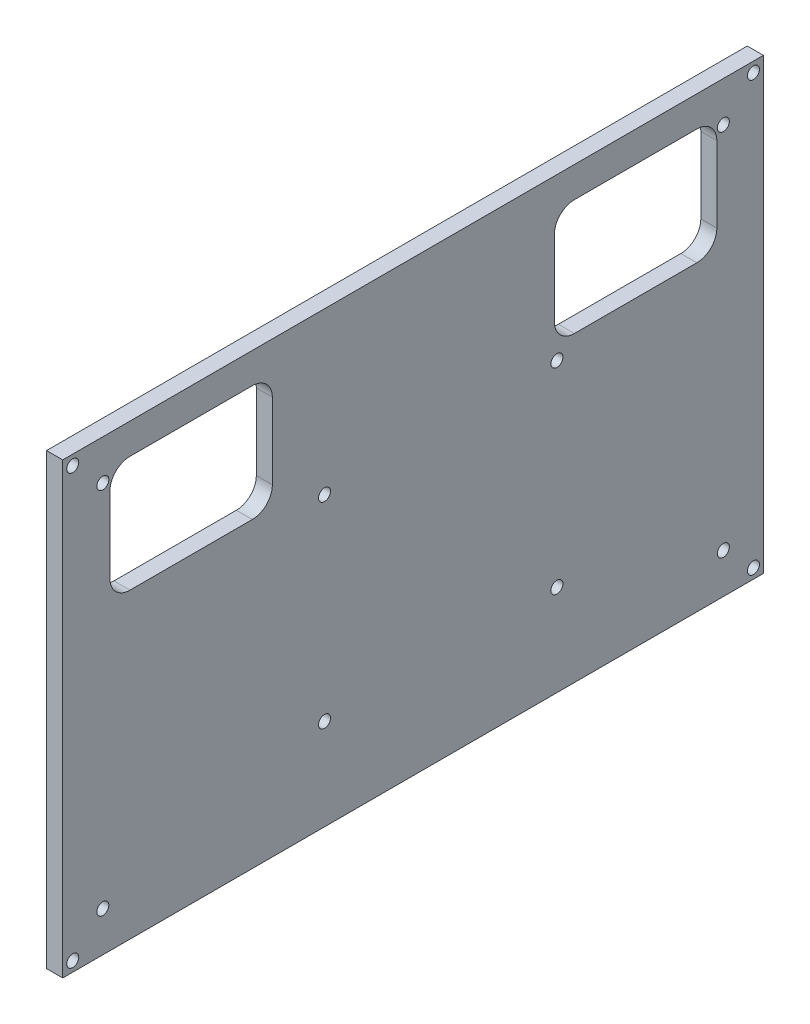
from build123d import *

# Parameters (mm, degrees)
CROQUIS1_W              = 164.9
CROQUIS1_H              = 102
SALIENTE_EXTRUIR2_DEPTH = 14.27
CROQUIS2_W              = 174.9
CROQUIS2_H              = 112
CROQUIS2_W_2            = 166.9
CROQUIS2_H_2            = 104
SALIENTE_EXTRUIR3_DEPTH = 14.27
CROQUIS3_W              = 174.9
CROQUIS3_H              = 112
CROQUIS3_W_2            = 160.9
CROQUIS3_H_2            = 98.374406292
SALIENTE_EXTRUIR5_DEPTH = 1
CROQUIS4_W              = 164.9
CROQUIS4_H              = 102
CORTAR_EXTRUIR2_DEPTH   = 14.27
CROQUIS6_W              = 174.9
CROQUIS6_H              = 112
CROQUIS6_R              = 1.5
SALIENTE_EXTRUIR6_DEPTH = 15
CROQUIS8_W              = 160.9
CROQUIS8_H              = 98.374406292
CORTAR_EXTRUIR3_DEPTH   = 9
CROQUIS9_W              = 166.9
CROQUIS9_H              = 104
CORTAR_EXTRUIR5_DEPTH   = 11
CROQUIS15_W             = 6.3
CROQUIS15_H             = 15
CROQUIS15_W_2           = 3.5
CROQUIS15_H_2           = 7
CORTAR_EXTRUIR6_DEPTH   = 7
CORTAR_EXTRUIR7_DEPTH   = 7
CROQUIS17_R             = 4
CORTAR_EXTRUIR8_DEPTH   = 7
CROQUIS18_W             = 4
CROQUIS18_H             = 16
CORTAR_EXTRUIR9_DEPTH   = 7
CROQUIS21_R             = 1.5
CORTAR_EXTRUIR12_DEPTH  = 25.4
CROQUIS22_W             = 26.235894962
CROQUIS22_H             = 112
CORTAR_EXTRUIR14_DEPTH  = 200.4


with BuildPart() as part:
    # Croquis1 → Saliente-Extruir2 (new body)
    with BuildSketch(Plane(origin=(0, 0, 0), x_dir=(0, 0, -1), z_dir=(1, 0, 0))):
        Rectangle(CROQUIS1_W, CROQUIS1_H)
    extrude(amount=SALIENTE_EXTRUIR2_DEPTH)

    # Croquis4 → Cortar-Extruir2 (cut)
    with BuildSketch(Plane(origin=(14.27, 0, 0), x_dir=(0, 0, -1), z_dir=(1, 0, 0))):
        Rectangle(CROQUIS4_W, CROQUIS4_H)
    extrude(amount=-CORTAR_EXTRUIR2_DEPTH, mode=Mode.SUBTRACT)


with BuildPart() as body_2:
    # Croquis2 → Saliente-Extruir3 (new body)
    with BuildSketch(Plane(origin=(0, 0, 0), x_dir=(0, 0, -1), z_dir=(1, 0, 0))):
        Rectangle(CROQUIS2_W, CROQUIS2_H)
        Rectangle(CROQUIS2_W_2, CROQUIS2_H_2, mode=Mode.SUBTRACT)
    extrude(amount=SALIENTE_EXTRUIR3_DEPTH)

    # Croquis3 → Saliente-Extruir5 (add)
    with BuildSketch(Plane.ZY):
        Rectangle(CROQUIS3_W, CROQUIS3_H)
        with Locations((0, -0.062203146)):
            Rectangle(CROQUIS3_W_2, CROQUIS3_H_2, mode=Mode.SUBTRACT)
    extrude(amount=SALIENTE_EXTRUIR5_DEPTH)

    # Croquis6 → Saliente-Extruir6 (add)
    with BuildSketch(Plane(origin=(14.27, 0, 0), x_dir=(0, 0, -1), z_dir=(1, 0, 0))):
        Rectangle(CROQUIS6_W, CROQUIS6_H)
        with Locations((-77.445, 46)):
            Circle(CROQUIS6_R, mode=Mode.SUBTRACT)
        with Locations((-77.445, -46)):
            Circle(CROQUIS6_R, mode=Mode.SUBTRACT)
        with Locations((-22.1, 15.81)):
            Circle(CROQUIS6_R, mode=Mode.SUBTRACT)
        with Locations((35.9, 15.81)):
            Circle(CROQUIS6_R, mode=Mode.SUBTRACT)
        with Locations((-22.1, -33.19)):
            Circle(CROQUIS6_R, mode=Mode.SUBTRACT)
        with Locations((35.9, -33.19)):
            Circle(CROQUIS6_R, mode=Mode.SUBTRACT)
        with Locations((77.445, 46)):
            Circle(CROQUIS6_R, mode=Mode.SUBTRACT)
        with Locations((77.445, -46)):
            Circle(CROQUIS6_R, mode=Mode.SUBTRACT)
    extrude(amount=SALIENTE_EXTRUIR6_DEPTH)

    # Croquis8 → Cortar-Extruir3 (cut)
    with BuildSketch(Plane.ZY.offset(-14.27)):
        with Locations((0, -0.062203146)):
            Rectangle(CROQUIS8_W, CROQUIS8_H)
    extrude(amount=-CORTAR_EXTRUIR3_DEPTH, mode=Mode.SUBTRACT)

    # Croquis9 → Cortar-Extruir5 (cut)
    with BuildSketch(Plane.ZY.offset(-14.27)):
        Rectangle(CROQUIS9_W, CROQUIS9_H)
    extrude(amount=-CORTAR_EXTRUIR5_DEPTH, mode=Mode.SUBTRACT)

    # Croquis15 → Cortar-Extruir6 (cut)
    with BuildSketch(Plane.XY.offset(87.45)):
        with Locations((18.42, 9.417324545)):
            Rectangle(CROQUIS15_W, CROQUIS15_H)
        with Locations((17.02, -11.082675455)):
            Rectangle(CROQUIS15_W_2, CROQUIS15_H_2)
        with Locations((17.02, -29.082675455)):
            Rectangle(CROQUIS15_W_2, CROQUIS15_H_2)
    extrude(amount=-CORTAR_EXTRUIR6_DEPTH, mode=Mode.SUBTRACT)

    # Croquis16 → Cortar-Extruir7 (cut)
    with BuildSketch(Plane(origin=(29.27, 0, 0), x_dir=(0, 0, -1), z_dir=(1, 0, 0))):
        with BuildLine():
            Line((-70.67585332, 19.450942007), (-40.125245351, 19.450942007))
            ThreePointArc((-40.125245351, 19.450942007), (-36.589711445, 20.915408101), (-35.125245351, 24.450942007))
            Line((-35.125245351, 24.450942007), (-35.125245351, 43.370497663))
            ThreePointArc((-35.125245351, 43.370497663), (-36.589711445, 46.906031569), (-40.125245351, 48.370497663))
            Line((-40.125245351, 48.370497663), (-70.67585332, 48.370497663))
            ThreePointArc((-70.67585332, 48.370497663), (-74.211387226, 46.906031569), (-75.67585332, 43.370497663))
            Line((-75.67585332, 43.370497663), (-75.67585332, 24.450942007))
            ThreePointArc((-75.67585332, 24.450942007), (-74.211387226, 20.915408101), (-70.67585332, 19.450942007))
        make_face()
        with BuildLine():
            Line((40.269537366, 19.465768949), (70.820145334, 19.465768949))
            ThreePointArc((70.820145334, 19.465768949), (74.35567924, 20.930235043), (75.820145334, 24.465768949))
            Line((75.820145334, 24.465768949), (75.820145334, 43.385324606))
            ThreePointArc((75.820145334, 43.385324606), (74.35567924, 46.920858512), (70.820145334, 48.385324606))
            Line((70.820145334, 48.385324606), (40.269537366, 48.385324606))
            ThreePointArc((40.269537366, 48.385324606), (36.73400346, 46.920858512), (35.269537366, 43.385324606))
            Line((35.269537366, 43.385324606), (35.269537366, 24.465768949))
            ThreePointArc((35.269537366, 24.465768949), (36.73400346, 20.930235043), (40.269537366, 19.465768949))
        make_face()
    extrude(amount=-CORTAR_EXTRUIR7_DEPTH, mode=Mode.SUBTRACT)

    # Croquis17 → Cortar-Extruir8 (cut)
    with BuildSketch(Plane(origin=(0, 0, -87.45), x_dir=(-1, 0, 0), z_dir=(0, 0, -1))):
        with Locations(Location((-17.79171335, -27.901665979, 0), (0, 0, 90))):
            Circle(CROQUIS17_R)
    extrude(amount=-CORTAR_EXTRUIR8_DEPTH, mode=Mode.SUBTRACT)

    # Croquis18 → Cortar-Extruir9 (cut)
    with BuildSketch(Plane(origin=(0, 0, -87.45), x_dir=(-1, 0, 0), z_dir=(0, 0, -1))):
        with Locations((-17.27, -3.082675455)):
            Rectangle(CROQUIS18_W, CROQUIS18_H)
    extrude(amount=-CORTAR_EXTRUIR9_DEPTH, mode=Mode.SUBTRACT)

    # Croquis21 → Cortar-Extruir12 (cut)
    with BuildSketch(Plane(origin=(29.27, 0, 0), x_dir=(0, 0, -1), z_dir=(1, 0, 0))):
        with Locations((-84.95, 53.5)):
            Circle(CROQUIS21_R)
        with Locations((84.95, 53.5)):
            Circle(CROQUIS21_R)
        with Locations((84.95, -53.5)):
            Circle(CROQUIS21_R)
        with Locations((-84.95, -53.5)):
            Circle(CROQUIS21_R)
    extrude(amount=-CORTAR_EXTRUIR12_DEPTH, mode=Mode.SUBTRACT)

    # Croquis22 → Cortar-Extruir14 (cut)
    with BuildSketch(Plane(origin=(0, 0, -87.45), x_dir=(-1, 0, 0), z_dir=(0, 0, -1))):
        with Locations((-12.117947481, 0)):
            Rectangle(CROQUIS22_W, CROQUIS22_H)
    extrude(amount=-CORTAR_EXTRUIR14_DEPTH, mode=Mode.SUBTRACT)


solid = body_2.part
